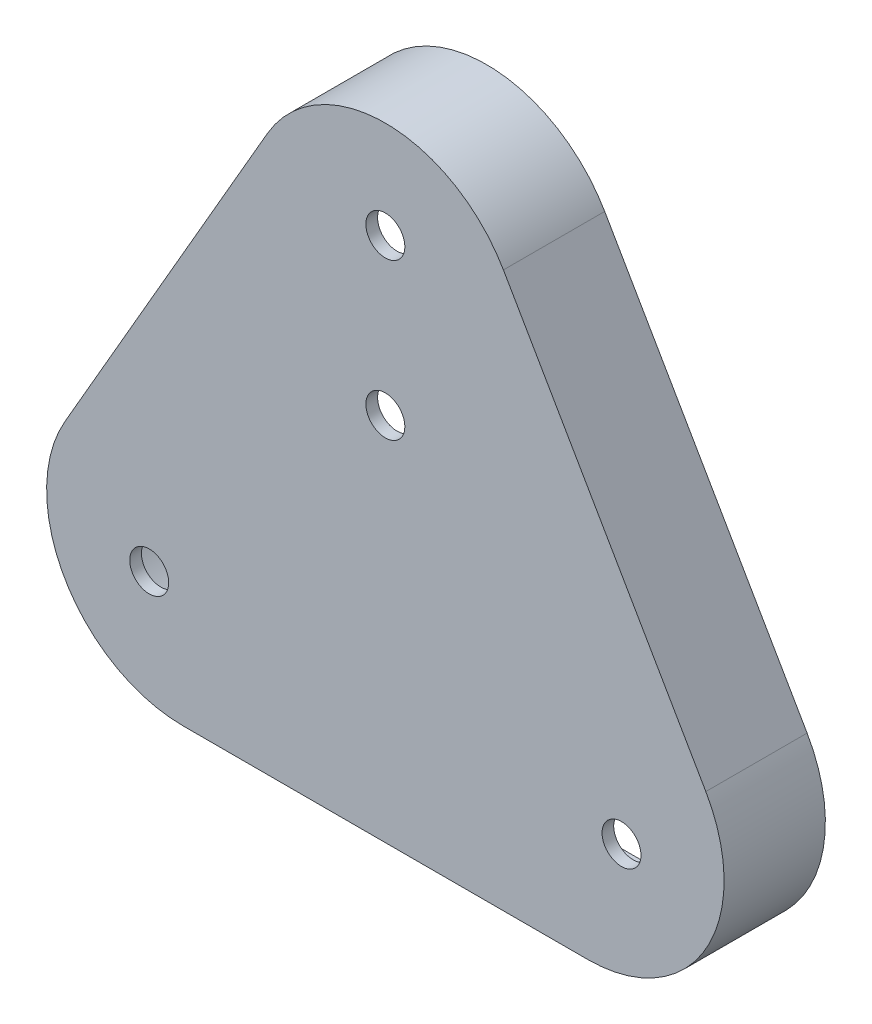
from build123d import *

# Parameters (mm, degrees)
RESSALTO_EXTRUS_O1_DEPTH = 3
RESSALTO_EXTRUS_O2_DEPTH = 20
RESSALTO_EXTRUS_O3_DEPTH = 3
ESBO_O4_R                = 5
CORTE_EXTRUS_O1_DEPTH    = 3


with BuildPart() as part:
    # Esboço1 → Ressalto-extrusão1 (new body)
    with BuildSketch(Plane.XY):
        with BuildLine():
            Line((51.961524227, -65), (-51.961524227, -65))
            ThreePointArc((-51.961524227, -65), (-82.27241336, -47.5), (-82.27241336, -12.5))
            Line((-82.27241336, -12.5), (-30.310889132, 77.5))
            ThreePointArc((-30.310889132, 77.5), (0, 95), (30.310889132, 77.5))
            Line((30.310889132, 77.5), (82.27241336, -12.5))
            ThreePointArc((82.27241336, -12.5), (82.27241336, -47.5), (51.961524227, -65))
        make_face()
        with BuildLine():
            Line((51.961524227, -62), (-51.961524227, -62))
            ThreePointArc((-51.961524227, -62), (-79.674337148, -46), (-79.674337148, -14))
            Line((-79.674337148, -14), (-27.712812921, 76))
            ThreePointArc((-27.712812921, 76), (0, 92), (27.712812921, 76))
            Line((27.712812921, 76), (79.674337148, -14))
            ThreePointArc((79.674337148, -14), (79.674337148, -46), (51.961524227, -62))
        make_face(mode=Mode.SUBTRACT)
    extrude(amount=RESSALTO_EXTRUS_O1_DEPTH)

    # Esboço2 → Ressalto-extrusão2 (add)
    with BuildSketch(Plane.XY.offset(3)):
        with BuildLine():
            Line((-51.961524227, -65), (51.961524227, -65))
            ThreePointArc((51.961524227, -65), (82.27241336, -47.5), (82.27241336, -12.5))
            Line((82.27241336, -12.5), (30.310889132, 77.5))
            ThreePointArc((30.310889132, 77.5), (0, 95), (-30.310889132, 77.5))
            Line((-30.310889132, 77.5), (-82.27241336, -12.5))
            ThreePointArc((-82.27241336, -12.5), (-82.27241336, -47.5), (-51.961524227, -65))
        make_face()
        with BuildLine():
            Line((-51.961524227, -61), (51.961524227, -61))
            ThreePointArc((51.961524227, -61), (78.808311744, -45.5), (78.808311744, -14.5))
            Line((78.808311744, -14.5), (26.846787517, 75.5))
            ThreePointArc((26.846787517, 75.5), (0, 91), (-26.846787517, 75.5))
            Line((-26.846787517, 75.5), (-78.808311744, -14.5))
            ThreePointArc((-78.808311744, -14.5), (-78.808311744, -45.5), (-51.961524227, -61))
        make_face(mode=Mode.SUBTRACT)
    extrude(amount=RESSALTO_EXTRUS_O2_DEPTH)

    # Esboço3 → Ressalto-extrusão3 (add)
    with BuildSketch(Plane.XY.offset(23)):
        with BuildLine():
            Line((-30.310889132, 77.5), (-82.27241336, -12.5))
            ThreePointArc((-82.27241336, -12.5), (-82.27241336, -47.5), (-51.961524227, -65))
            Line((-51.961524227, -65), (51.961524227, -65))
            ThreePointArc((51.961524227, -65), (82.27241336, -47.5), (82.27241336, -12.5))
            Line((82.27241336, -12.5), (30.310889132, 77.5))
            ThreePointArc((30.310889132, 77.5), (0, 95), (-30.310889132, 77.5))
        make_face()
    extrude(amount=RESSALTO_EXTRUS_O3_DEPTH)

    # Esboço4 → Corte-extrusão1 (cut)
    with BuildSketch(Plane.XY.offset(26)):
        with Locations((0, 70)):
            Circle(ESBO_O4_R)
        with Locations((60.621778265, -35)):
            Circle(ESBO_O4_R)
        with Locations((-60.621778265, -35)):
            Circle(ESBO_O4_R)
        with Locations((0, 30)):
            Circle(ESBO_O4_R)
    extrude(amount=-CORTE_EXTRUS_O1_DEPTH, mode=Mode.SUBTRACT)


solid = part.part
